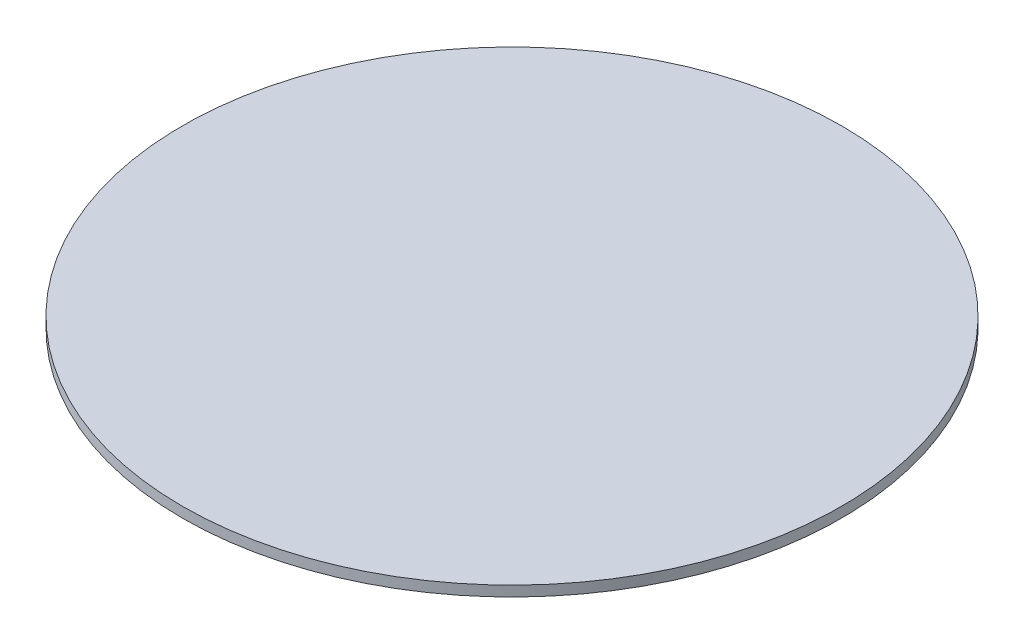
from build123d import *

# Parameters (mm, degrees)
SKETCH1_R           = 50.8
BOSS_EXTRUDE1_DEPTH = 1.59


with BuildPart() as part:
    # Sketch1 → Boss-Extrude1 (new body)
    with BuildSketch(Plane(origin=(0, 0, 0), x_dir=(1, 0, 0), z_dir=(0, 1, 0))):
        with Locations(Location((0, 0, 0), (0, 0, 90))):
            Circle(SKETCH1_R)
    extrude(amount=BOSS_EXTRUDE1_DEPTH)


solid = part.part
